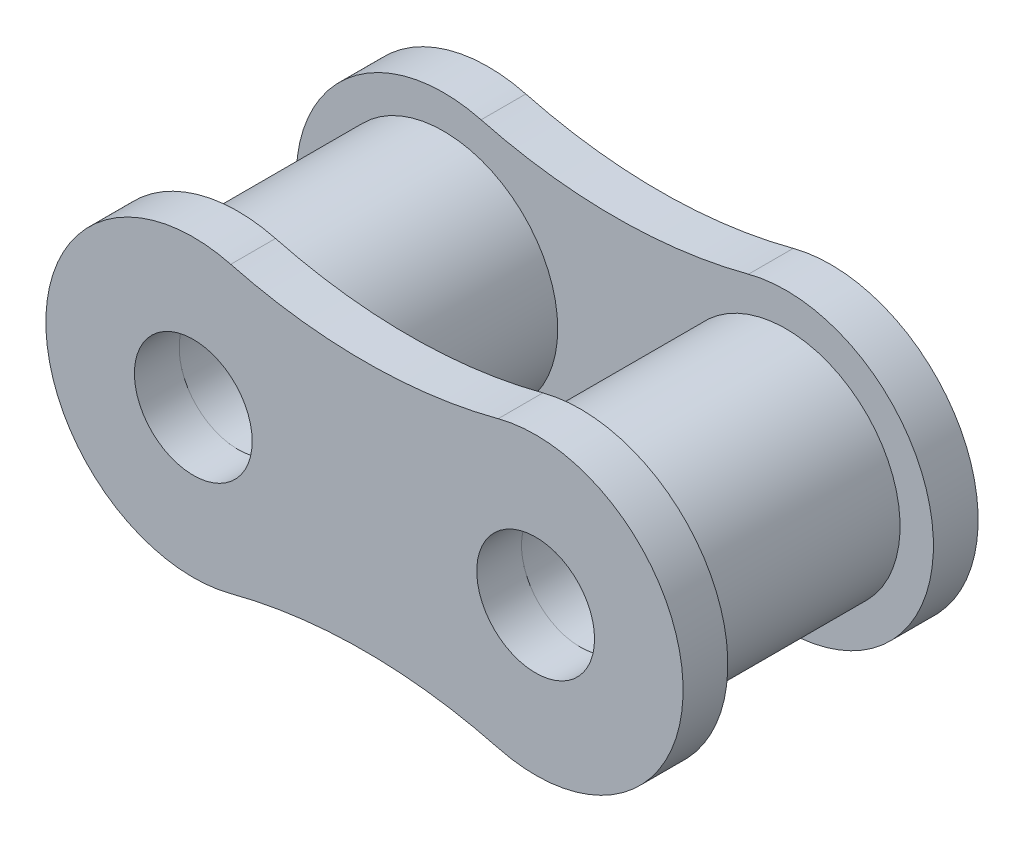
from build123d import *

# Parameters (mm, degrees)
SKETCH4_R             = 3.175
SKETCH4_R_2           = 1.6637
BOSS_EXTRUDE1_DEPTH   = 2.86
BOSS_EXTRUDE1_2_DEPTH = 2.86
SKETCH5_R             = 1.6383
BOSS_EXTRUDE2_DEPTH   = 1.2446


with BuildPart() as part:
    # Sketch4 → Boss-Extrude1 (new, symmetric)
    with BuildSketch(Plane.XY):
        with Locations((-4.7625, 0)):
            Circle(SKETCH4_R)
        with Locations((-4.7625, 0)):
            Circle(SKETCH4_R_2, mode=Mode.SUBTRACT)
    extrude(amount=BOSS_EXTRUDE1_DEPTH, both=True)


with BuildPart() as body_2:
    # Sketch4 → Boss-Extrude1 2 (new, symmetric)
    with BuildSketch(Plane.XY):
        with Locations((4.7625, 0)):
            Circle(SKETCH4_R)
        with Locations((4.7625, 0)):
            Circle(SKETCH4_R_2, mode=Mode.SUBTRACT)
    extrude(amount=BOSS_EXTRUDE1_2_DEPTH, both=True)


with BuildPart() as body_3:
    # Sketch5 → Boss-Extrude2 (new body)
    with BuildSketch(Plane.XY.offset(2.86)):
        with BuildLine():
            ThreePointArc((-3.71992076, 3.967398762), (-8.8646, 0), (-3.71992076, -3.967398762))
            ThreePointArc((-3.71992076, -3.967398762), (0, -3.486785), (3.71992076, -3.967398762))
            ThreePointArc((3.71992076, -3.967398762), (8.8646, 0), (3.71992076, 3.967398762))
            ThreePointArc((3.71992076, 3.967398762), (0, 3.486785), (-3.71992076, 3.967398762))
        make_face()
        with Locations((-4.7625, 0)):
            Circle(SKETCH5_R, mode=Mode.SUBTRACT)
        with Locations((4.7625, 0)):
            Circle(SKETCH5_R, mode=Mode.SUBTRACT)
    boss_extrude2 = extrude(amount=BOSS_EXTRUDE2_DEPTH)


with BuildPart() as part_1:
    add(part.part)

    add(body_2.part)  # Mirror2 merges body 2
    # Mirror2: Boss-Extrude2 across plane
    add(boss_extrude2.mirror(Plane.XY))


solid = Compound([body_3.part, part_1.part])
